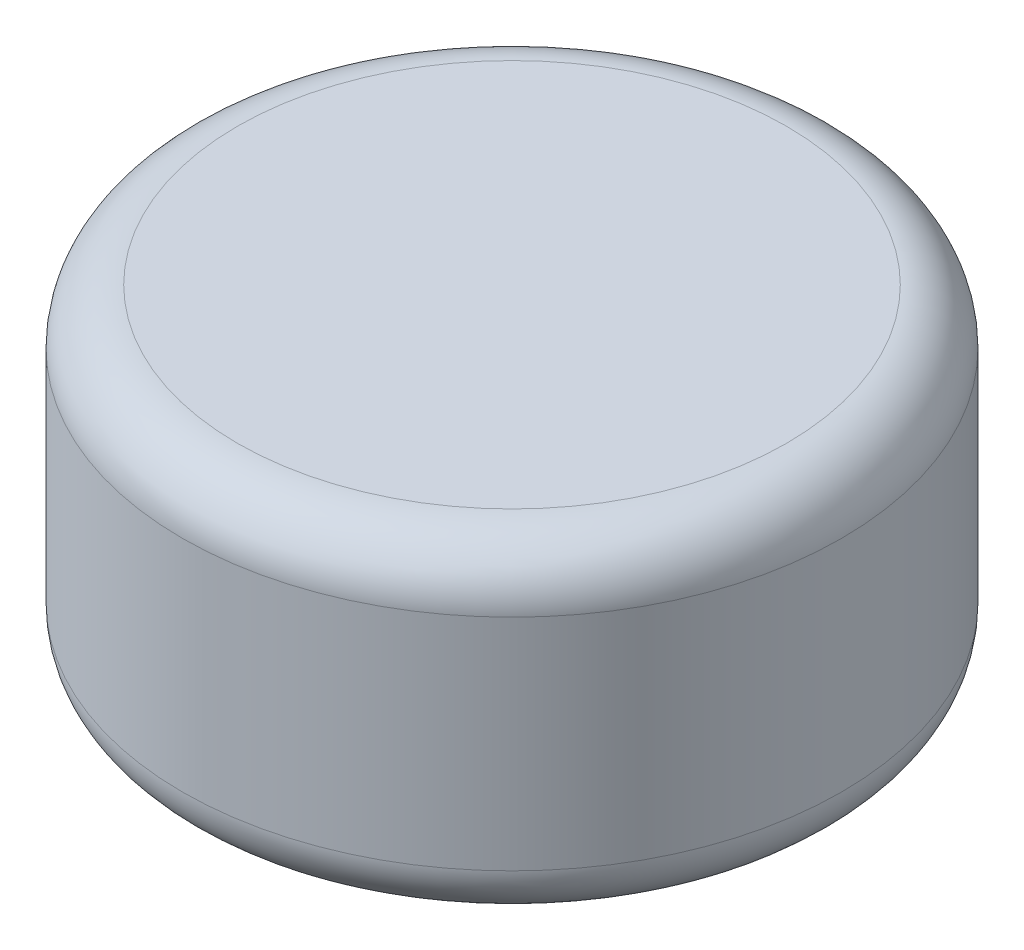
from build123d import *

# Parameters (mm, degrees)
SKETCH2_R           = 3
BOSS_EXTRUDE1_DEPTH = 3
FILLET1_R           = 0.5
FILLET2_R           = 0.5


with BuildPart() as part:
    # Sketch2 → Boss-Extrude1 (new body)
    with BuildSketch(Plane(origin=(0, 0, 0), x_dir=(1, 0, 0), z_dir=(0, 1, 0))):
        with Locations(Location((0, 0, 0), (0, 0, 270))):
            Circle(SKETCH2_R)
    extrude(amount=BOSS_EXTRUDE1_DEPTH)

    # Fillet1
    fillet1_edges = [part.edges().sort_by_distance(p)[0] for p in [
        (0, 3, -3),
    ]]
    fillet(fillet1_edges, radius=FILLET1_R)

    # Fillet2
    fillet2_edges = [part.edges().sort_by_distance(p)[0] for p in [
        (0, 0, -3),
    ]]
    fillet(fillet2_edges, radius=FILLET2_R)


solid = part.part
